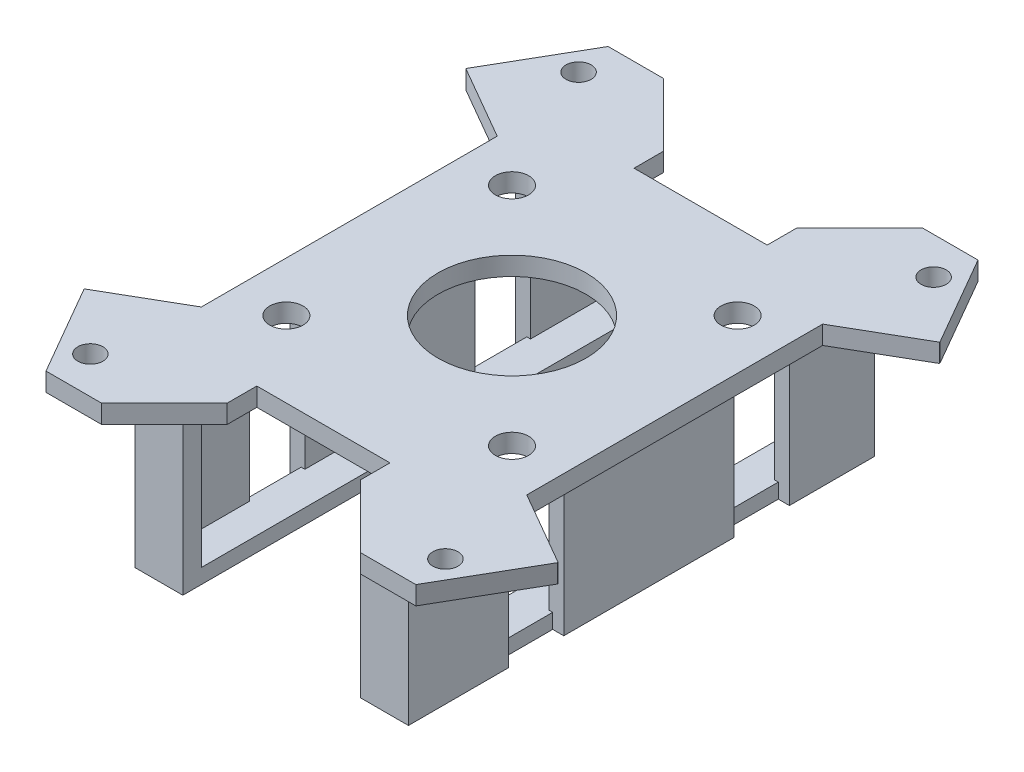
from build123d import *

# Parameters (mm, degrees)
SKETCH_1_W          = 64
SKETCH_1_H          = 76
SKETCH_1_R          = 2.25
SKETCH_1_R_2        = 1.7
EXTRUDE_1_DEPTH     = 2.5
EXTRUDE_START       = -20
SKETCH_2_W          = 5
SKETCH_2_H          = 61
EXTRUDE_2_DEPTH     = 2
EXTRUDE_2_2_DEPTH   = 2
SKETCH_3_W          = 2
SKETCH_3_H          = 11.5
EXTRUDE_3_DEPTH     = 20
SKETCH_4_W          = 6.5
SKETCH_4_H          = 2.5
EXTRUDE_4_DEPTH     = 20
SKETCH_5_R          = 10
CUT_EXTRUDE_1_DEPTH = 10


with BuildPart() as part:
    # 草图1 → 凸台-拉伸1 (new body)
    with BuildSketch(Plane(origin=(0, 0, 0), x_dir=(1, 0, 0), z_dir=(0, 1, 0))):
        Rectangle(SKETCH_1_W, SKETCH_1_H)
        with Locations(Location((-15.25, 15.25, 0), (0, 0, 270))):
            Circle(SKETCH_1_R, mode=Mode.SUBTRACT)
        with Locations(Location((-24, -33, 0), (0, 0, 270))):
            Circle(SKETCH_1_R_2, mode=Mode.SUBTRACT)
        with Locations(Location((24, -33, 0), (0, 0, 90))):
            Circle(SKETCH_1_R_2, mode=Mode.SUBTRACT)
        with Locations(Location((24, 33, 0), (0, 0, 270))):
            Circle(SKETCH_1_R_2, mode=Mode.SUBTRACT)
        with Locations(Location((-24, 33, 0), (0, 0, 90))):
            Circle(SKETCH_1_R_2, mode=Mode.SUBTRACT)
        with Locations(Location((15.25, 15.25, 0), (0, 0, 90))):
            Circle(SKETCH_1_R, mode=Mode.SUBTRACT)
        with Locations(Location((15.25, -15.25, 0), (0, 0, 270))):
            Circle(SKETCH_1_R, mode=Mode.SUBTRACT)
        with Locations(Location((-15.25, -15.25, 0), (0, 0, 90))):
            Circle(SKETCH_1_R, mode=Mode.SUBTRACT)
    extrude(amount=EXTRUDE_1_DEPTH)



with BuildPart() as body_2:
    # 草图2 → 凸台-拉伸2 (new body)
    with BuildSketch(Plane(origin=(0, 0, 0), x_dir=(1, 0, 0), z_dir=(0, 1, 0)).offset(EXTRUDE_START)):
        with Locations((14.5, 0)):
            Rectangle(SKETCH_2_W, SKETCH_2_H)
    extrude(amount=EXTRUDE_2_DEPTH)


with BuildPart() as body_3:
    # 草图2 → Extrude 2 2 (new body)
    with BuildSketch(Plane(origin=(0, 0, 0), x_dir=(1, 0, 0), z_dir=(0, 1, 0)).offset(EXTRUDE_START)):
        with Locations((-14.5, 0)):
            Rectangle(SKETCH_2_W, SKETCH_2_H)
    extrude(amount=EXTRUDE_2_2_DEPTH)


with BuildPart() as part_1:
    add(part.part)

    add(body_2.part)  # 凸台-拉伸3 merges body 2

    add(body_3.part)  # 凸台-拉伸3 merges body 3
    # 草图3 → 凸台-拉伸3 (add)
    with BuildSketch(Plane(origin=(0, 0, 0), x_dir=(1, 0, 0), z_dir=(0, 1, 0)).offset(EXTRUDE_START)):
        with Locations((17.5, -24.75)):
            Rectangle(SKETCH_3_W, SKETCH_3_H)
        with Locations((-17.5, -24.75)):
            Rectangle(SKETCH_3_W, SKETCH_3_H)
        Polygon((16.5, -1), (16.5, 11.5), (18.5, 11.5), (18.5, -1), (18.5, -11.5), (16.5, -11.5), align=None)
        with Locations((17.5, 24.75)):
            Rectangle(SKETCH_3_W, SKETCH_3_H)
        Polygon((-18.5, -1), (-18.5, 11.5), (-16.5, 11.5), (-16.5, -1), (-16.5, -11.5), (-18.5, -11.5), align=None)
        with Locations((-17.5, 24.75)):
            Rectangle(SKETCH_3_W, SKETCH_3_H)
    extrude(amount=EXTRUDE_3_DEPTH)

    # 草图4 → 凸台-拉伸4 (add)
    with BuildSketch(Plane(origin=(0, 0, 0), x_dir=(1, 0, 0), z_dir=(0, 1, 0)).offset(EXTRUDE_START)):
        with Locations((-15.25, -31.25)):
            Rectangle(SKETCH_4_W, SKETCH_4_H)
        with Locations((15.25, -31.25)):
            Rectangle(SKETCH_4_W, SKETCH_4_H)
    extrude(amount=EXTRUDE_4_DEPTH)

    # 草图5 → 切除-拉伸1 (cut)
    with BuildSketch(Plane.XZ):
        with Locations(Location((0, 0, 0), (0, 0, 270))):
            Circle(SKETCH_5_R)
        Polygon((-22, 20), (-22, -20), (-32, -25.773502692), (-32, 25.773502692), align=None)
        Polygon((22, 20), (32, 25.773502692), (32, -25.773502692), (22, -20), align=None)
        Polygon((-17.5, 38), (17.5, 38), (9, 29.5), (9, 25.5), (-9, 25.5), (-9, 29.5), align=None)
        Polygon((-32, -25.875644347), (-25, -38), (-32, -38), align=None)
        Polygon((32, -25.875644347), (32, -38), (25, -38), align=None)
        Polygon((32, 25.875644347), (25, 38), (32, 38), align=None)
        Polygon((-32, 25.875644347), (-32, 38), (-25, 38), align=None)
        Polygon((17.5, -38), (9, -29.5), (9, -25.5), (-9, -25.5), (-9, -29.5), (-17.5, -38), align=None)
    extrude(amount=-CUT_EXTRUDE_1_DEPTH, mode=Mode.SUBTRACT)


solid = part_1.part
